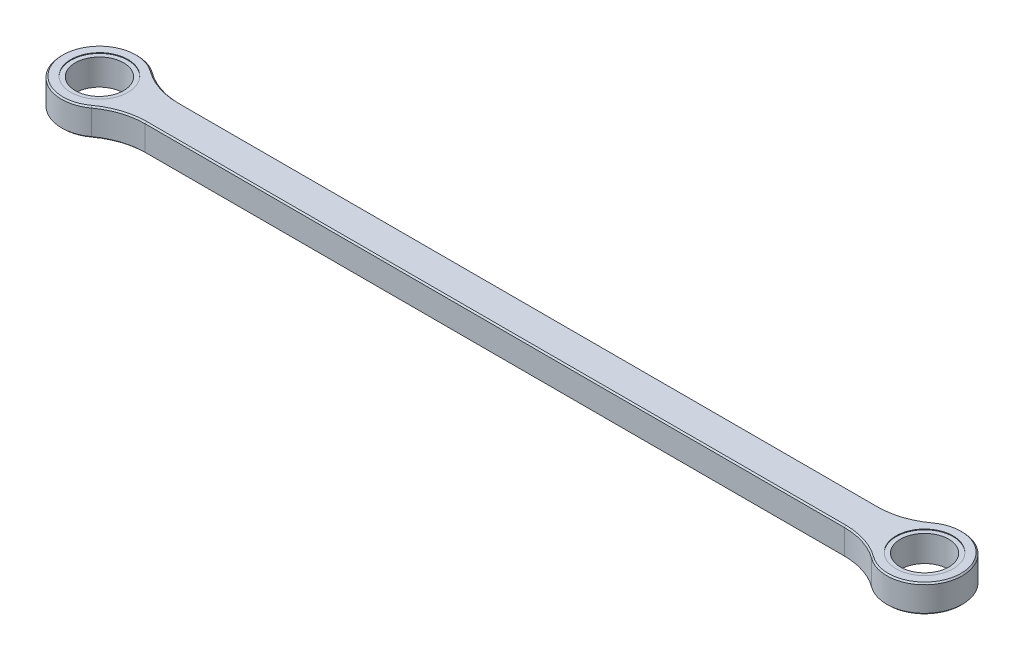
from build123d import *

# Parameters (mm, degrees)
SKETCH_1_R          = 3.515
EXTRUDE_1_DEPTH     = 4
FILLET_1_R          = 10
CHAMFER_1_SIZE      = 0.2
SKETCH_3_R          = 4.15
CUT_EXTRUDE_2_DEPTH = 0.1
SKETCH_4_R          = 4.125
CUT_EXTRUDE_3_DEPTH = 0.1


with BuildPart() as part:
    # 草图1 → 凸台-拉伸1 (new body)
    with BuildSketch(Plane(origin=(0, 0, 0), x_dir=(1, 0, 0), z_dir=(0, 1, 0))):
        with BuildLine():
            Line((4.898979486, 2.5), (115.101020514, 2.5))
            ThreePointArc((115.101020514, 2.5), (125.5, 0), (115.101020514, -2.5))
            Line((115.101020514, -2.5), (4.898979486, -2.5))
            ThreePointArc((4.898979486, -2.5), (-5.5, 0), (4.898979486, 2.5))
        make_face()
        with Locations(Location((0, 0, 0), (0, 0, 270))):
            Circle(SKETCH_1_R, mode=Mode.SUBTRACT)
        with Locations(Location((120, 0, 0), (0, 0, 270))):
            Circle(SKETCH_1_R, mode=Mode.SUBTRACT)
    extrude(amount=EXTRUDE_1_DEPTH)

    # 圆角1
    fillet_1_edges = [part.edges().sort_by_distance(p)[0] for p in [
        (4.898979486, 2, -2.5),
        (115.101020514, 2, -2.5),
        (115.101020514, 2, 2.5),
        (4.898979486, 2, 2.5),
    ]]
    fillet(fillet_1_edges, radius=FILLET_1_R)

    # 倒角1
    chamfer_1_edges = [part.edges().sort_by_distance(p)[0] for p in [
        (125.5, 0, 0),
        (125.5, 4, 0),
        (60, 0, 2.5),
        (60, 4, 2.5),
        (60, 0, -2.5),
        (60, 4, -2.5),
        (-5.5, 0, 0),
        (-5.5, 4, 0),
        (113.945703694, 0, 2.996180734),
        (113.945703694, 4, 2.996180734),
        (113.945703694, 0, -2.996180734),
        (113.945703694, 4, -2.996180734),
        (6.054296306, 0, 2.996180734),
        (6.054296306, 4, 2.996180734),
        (6.054296306, 0, -2.996180734),
        (6.054296306, 4, -2.996180734),
    ]]
    chamfer(chamfer_1_edges, length=CHAMFER_1_SIZE)

    # 草图3 → 切除-拉伸2 (cut)
    with BuildSketch(Plane(origin=(0, 4, 0), x_dir=(1, 0, 0), z_dir=(0, 1, 0))):
        with Locations(Location((0, 0, 0), (0, 0, 270))):
            Circle(SKETCH_3_R)
        with Locations(Location((120, 0, 0), (0, 0, 270))):
            Circle(SKETCH_3_R)
    extrude(amount=-CUT_EXTRUDE_2_DEPTH, mode=Mode.SUBTRACT)

    # 草图4 → 切除-拉伸3 (cut)
    with BuildSketch(Plane.XZ):
        with Locations(Location((0, 0, 0), (0, 0, 270))):
            Circle(SKETCH_4_R)
        with Locations(Location((120, 0, 0), (0, 0, 270))):
            Circle(SKETCH_4_R)
    extrude(amount=-CUT_EXTRUDE_3_DEPTH, mode=Mode.SUBTRACT)


solid = part.part
